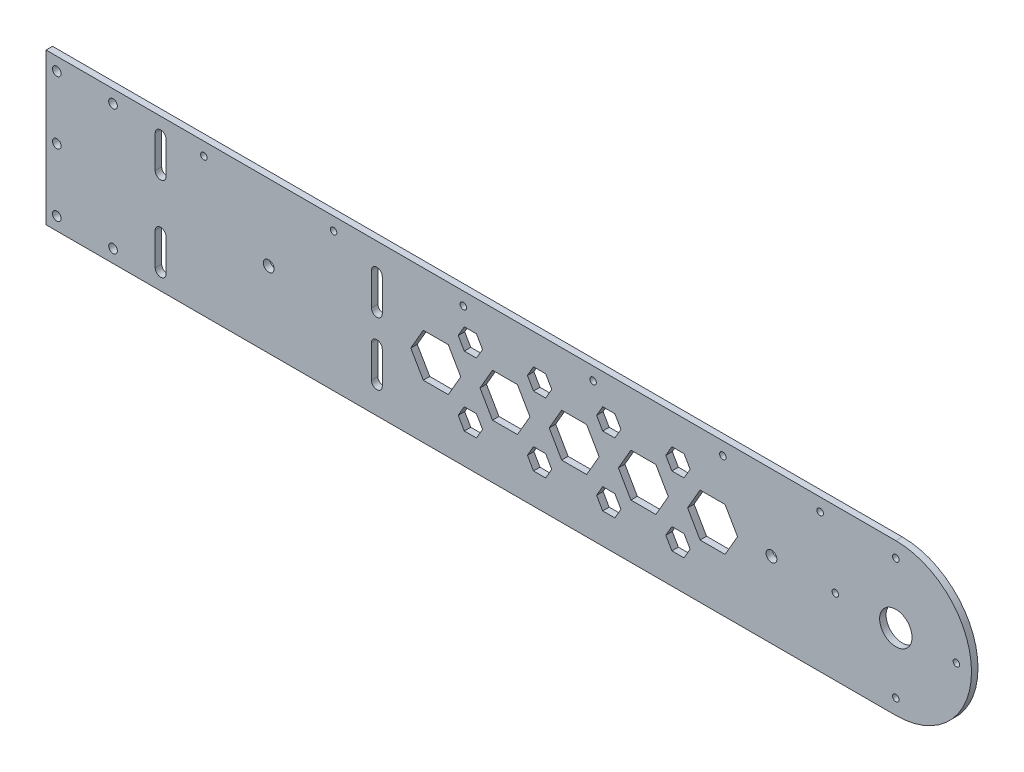
from build123d import *

# Parameters (mm, degrees)
SKETCH1_R               = 2
SKETCH1_R_2             = 7.5
SKETCH1_R_3             = 2.5
BOSS_EXTRUDE1_DEPTH     = 3
CUT_EXTRUDE1_DEPTH      = 430.43916915
CUT_EXTRUDE1_DEPTH_BACK = 430.43916915
CUT_EXTRUDE2_DEPTH      = 430.43916915
CUT_EXTRUDE2_DEPTH_BACK = 430.43916915
SKETCH5_R               = 2.5
CUT_EXTRUDE3_DEPTH      = 430.43916915
CUT_EXTRUDE3_DEPTH_BACK = 430.43916915
SKETCH6_R               = 1.500000001
SKETCH6_R_2             = 1.5
SKETCH6_R_3             = 1.499999999
SKETCH7_R               = 1.5
CUT_EXTRUDE4_DEPTH      = 3
CUT_EXTRUDE5_DEPTH      = 430.43916915


with BuildPart() as part:
    # Sketch1 → Boss-Extrude1 (new body)
    with BuildSketch(Plane.XY):
        with BuildLine():
            Line((0, 35), (0, -35))
            Line((0, -35), (393, -35))
            ThreePointArc((393, -35), (428, 0), (393, 35))
            Line((393, 35), (0, 35))
        make_face()
        with Locations((5, 29)):
            Circle(SKETCH1_R, mode=Mode.SUBTRACT)
        with Locations(Location((5, -29, 0), (0, 0, 180))):
            Circle(SKETCH1_R, mode=Mode.SUBTRACT)
        with Locations((393, 0)):
            Circle(SKETCH1_R_2, mode=Mode.SUBTRACT)
        with Locations((103, 0)):
            Circle(SKETCH1_R_3, mode=Mode.SUBTRACT)
        with Locations((31, 29)):
            Circle(SKETCH1_R, mode=Mode.SUBTRACT)
        with Locations((31, -29)):
            Circle(SKETCH1_R, mode=Mode.SUBTRACT)
        with Locations((5, 0)):
            Circle(SKETCH1_R, mode=Mode.SUBTRACT)
    extrude(amount=BOSS_EXTRUDE1_DEPTH)

    # Sketch4 → Cut-Extrude1 (cut, two sides: drawn at the far end of the back side and taken through both)
    with BuildSketch(Plane.XY.offset(3).offset(-CUT_EXTRUDE1_DEPTH_BACK)):
        with BuildLine():
            Line((55.5, 27), (55.5, 12))
            ThreePointArc((55.5, 12), (53, 9.5), (50.5, 12))
            Line((50.5, 12), (50.5, 27))
            ThreePointArc((50.5, 27), (53, 29.5), (55.5, 27))
        make_face()
        with BuildLine():
            Line((155.5, 22), (155.5, 7))
            ThreePointArc((155.5, 7), (153, 4.5), (150.5, 7))
            Line((150.5, 7), (150.5, 22))
            ThreePointArc((150.5, 22), (153, 24.5), (155.5, 22))
        make_face()
        with BuildLine():
            Line((155.5, -22), (155.5, -7))
            ThreePointArc((155.5, -7), (153, -4.5), (150.5, -7))
            Line((150.5, -7), (150.5, -22))
            ThreePointArc((150.5, -22), (153, -24.5), (155.5, -22))
        make_face()
        with BuildLine():
            Line((55.5, -27), (55.5, -12))
            ThreePointArc((55.5, -12), (53, -9.5), (50.5, -12))
            Line((50.5, -12), (50.5, -27))
            ThreePointArc((50.5, -27), (53, -29.5), (55.5, -27))
        make_face()
    extrude(amount=CUT_EXTRUDE1_DEPTH + CUT_EXTRUDE1_DEPTH_BACK, mode=Mode.SUBTRACT)

    # Sketch5 → Cut-Extrude2 (cut, two sides: drawn at the far end of the back side and taken through both)
    with BuildSketch(Plane.XY.offset(3).offset(-CUT_EXTRUDE2_DEPTH_BACK)):
        with Locations((335.5, 0)):
            Circle(SKETCH5_R)
    extrude(amount=CUT_EXTRUDE2_DEPTH + CUT_EXTRUDE2_DEPTH_BACK, mode=Mode.SUBTRACT)

    # Sketch6 → Cut-Extrude3 (cut, two sides: drawn at the far end of the back side and taken through both)
    with BuildSketch(Plane.XY.offset(3).offset(-CUT_EXTRUDE3_DEPTH_BACK)):
        with Locations((420.999999999, 1e-09)):
            Circle(SKETCH6_R)
        with Locations((393, -27.999999998)):
            Circle(SKETCH6_R_2)
        with Locations((393, 28)):
            Circle(SKETCH6_R_2)
        with Locations((365.000000001, 1e-09)):
            Circle(SKETCH6_R_3)
    extrude(amount=CUT_EXTRUDE3_DEPTH + CUT_EXTRUDE3_DEPTH_BACK, mode=Mode.SUBTRACT)

    # Sketch7 → Cut-Extrude4 (cut)
    with BuildSketch(Plane.XY.offset(3)):
        with Locations((73, 29)):
            Circle(SKETCH7_R)
        with Locations((133, 29)):
            Circle(SKETCH7_R)
        with Locations((193, 29)):
            Circle(SKETCH7_R)
        with Locations((253, 29)):
            Circle(SKETCH7_R)
        with Locations((313, 29)):
            Circle(SKETCH7_R)
        with Locations((358, 29)):
            Circle(SKETCH7_R)
    extrude(amount=-CUT_EXTRUDE4_DEPTH, mode=Mode.SUBTRACT)

    # Sketch8 → Cut-Extrude5 (cut, through all)
    with BuildSketch(Plane.XY.offset(3)):
        Polygon((223.795, 0), (218.021497308, 10), (206.474491924, 10), (200.700989232, 0), (206.474491924, -10), (218.021497308, -10), align=None)
        Polygon((191.795, 0), (186.021497308, 10), (174.474491924, 10), (168.700989232, 0), (174.474491924, -10), (186.021497308, -10), align=None)
        Polygon((255.795, 0), (250.021497308, 10), (238.474491924, 10), (232.700989232, 0), (238.474491924, -10), (250.021497308, -10), align=None)
        Polygon((287.795, 0), (282.021497308, 10), (270.474491924, 10), (264.700989232, 0), (270.474491924, -10), (282.021497308, -10), align=None)
        Polygon((233.865777575, 16), (231.056886095, 20.865142755), (225.439103137, 20.865142755), (222.630211658, 16), (225.439103137, 11.134857245), (231.056886095, 11.134857245), align=None)
        Polygon((201.865777575, 16), (199.056886095, 20.865142755), (193.439103137, 20.865142755), (190.630211658, 16), (193.439103137, 11.134857245), (199.056886095, 11.134857245), align=None)
        Polygon((265.865777575, 16), (263.056886095, 20.865142755), (257.439103137, 20.865142755), (254.630211658, 16), (257.439103137, 11.134857245), (263.056886095, 11.134857245), align=None)
        Polygon((319.795, 0), (314.021497308, 10), (302.474491924, 10), (296.700989232, 0), (302.474491924, -10), (314.021497308, -10), align=None)
        Polygon((297.865777575, 16), (295.056886095, 20.865142755), (289.439103137, 20.865142755), (286.630211658, 16), (289.439103137, 11.134857245), (295.056886095, 11.134857245), align=None)
        Polygon((295.056886095, -11.134857245), (297.865777575, -16), (295.056886095, -20.865142755), (289.439103137, -20.865142755), (286.630211658, -16), (289.439103137, -11.134857245), align=None)
        Polygon((263.056886095, -11.134857245), (265.865777575, -16), (263.056886095, -20.865142755), (257.439103137, -20.865142755), (254.630211658, -16), (257.439103137, -11.134857245), align=None)
        Polygon((231.056886095, -11.134857245), (233.865777575, -16), (231.056886095, -20.865142755), (225.439103137, -20.865142755), (222.630211658, -16), (225.439103137, -11.134857245), align=None)
        Polygon((199.056886095, -11.134857245), (201.865777575, -16), (199.056886095, -20.865142755), (193.439103137, -20.865142755), (190.630211658, -16), (193.439103137, -11.134857245), align=None)
    extrude(amount=-CUT_EXTRUDE5_DEPTH, mode=Mode.SUBTRACT)


solid = part.part
